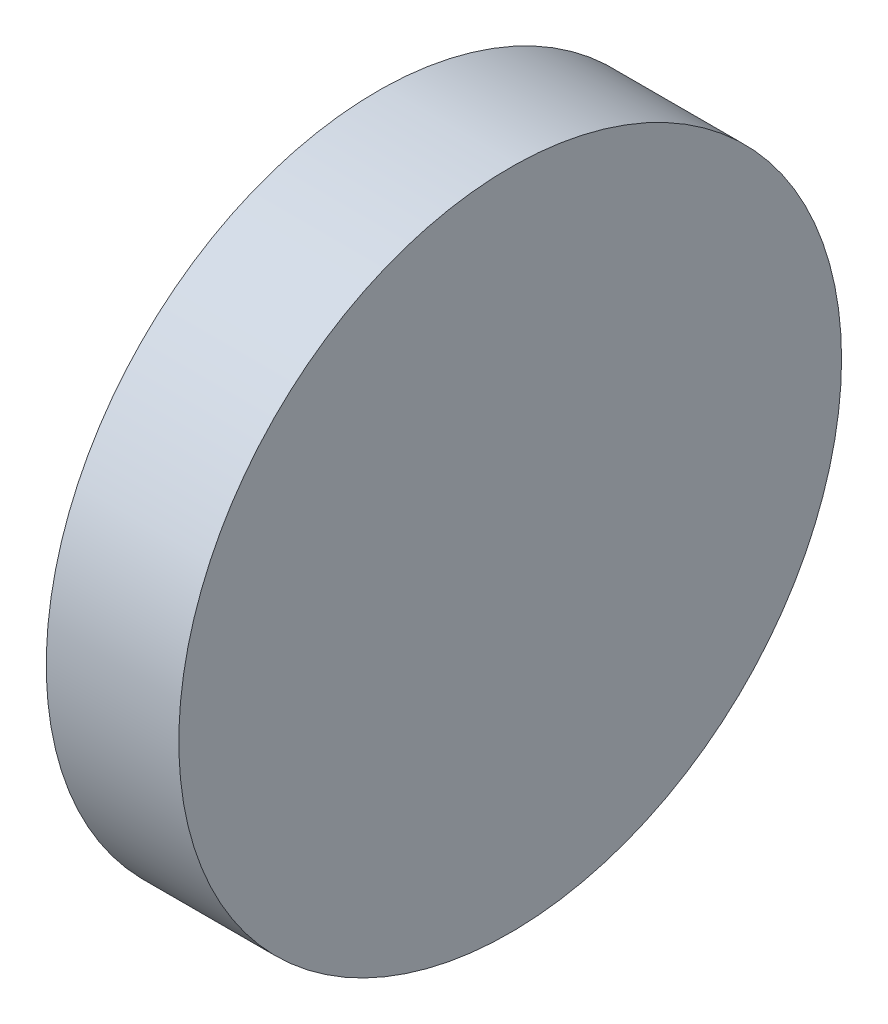
from build123d import *

# Parameters (mm, degrees)
SKETCH_1_R          = 5
EXTRUDE_301_DEPTH   = 2
SKETCH_9_R          = 4.442422665
CUT_EXTRUDE_2_DEPTH = 0.2
SKETCH_10_R         = 0.75956549
CUT_EXTRUDE_3_DEPTH = 0.6
SKETCH_11_R         = 0.278093265
CUT_EXTRUDE_4_DEPTH = 0.6


with BuildPart() as part:
    # 草图1 → Extrude 301 (new body)
    with BuildSketch(Plane(origin=(0, 0, 0), x_dir=(0, 0, -1), z_dir=(1, 0, 0))):
        Circle(SKETCH_1_R)
    extrude(amount=EXTRUDE_301_DEPTH)

    # 草图9 → 切除-拉伸2 (cut)
    with BuildSketch(Plane.ZY):
        Circle(SKETCH_9_R)
    extrude(amount=-CUT_EXTRUDE_2_DEPTH, mode=Mode.SUBTRACT)

    # 草图10 → 切除-拉伸3 (cut)
    with BuildSketch(Plane.ZY.offset(-0.2)):
        Circle(SKETCH_10_R)
    extrude(amount=-CUT_EXTRUDE_3_DEPTH, mode=Mode.SUBTRACT)

    # 草图11 → 切除-拉伸4 (cut)
    with BuildSketch(Plane.ZY.offset(-0.8)):
        Circle(SKETCH_11_R)
    extrude(amount=-CUT_EXTRUDE_4_DEPTH, mode=Mode.SUBTRACT)


solid = part.part
